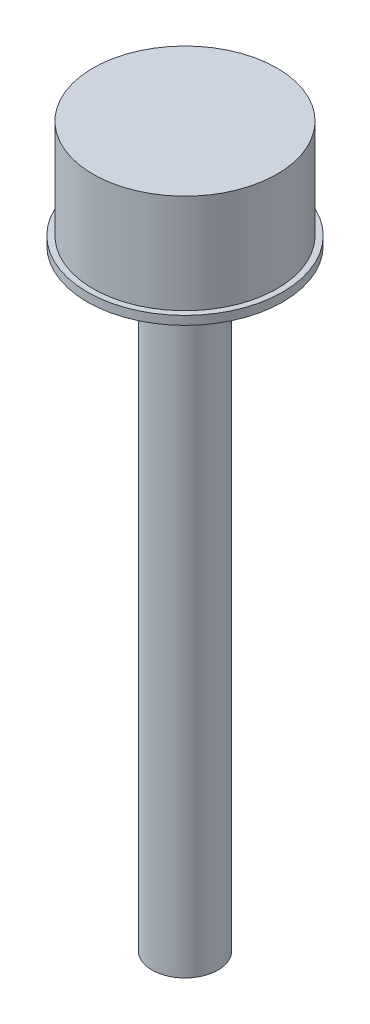
from build123d import *


with BuildPart() as part:
    # Sketch1 → Revolve1 (revolve)
    with BuildSketch(Plane.XY, mode=Mode.PRIVATE) as revolve1_sk:
        Polygon((0, 0), (0, 127), (-16.256, 127), (-16.256, 109.474), (-17.272, 109.474), (-17.272, 107.95), (-5.842, 107.95), (-5.842, 0), align=None)
    revolve(revolve1_sk.sketch.rotate(Axis((0, 0, 0), (0, 1, 0)), 270), axis=Axis((0, 0, 0), (0, 1, 0)))


solid = part.part
